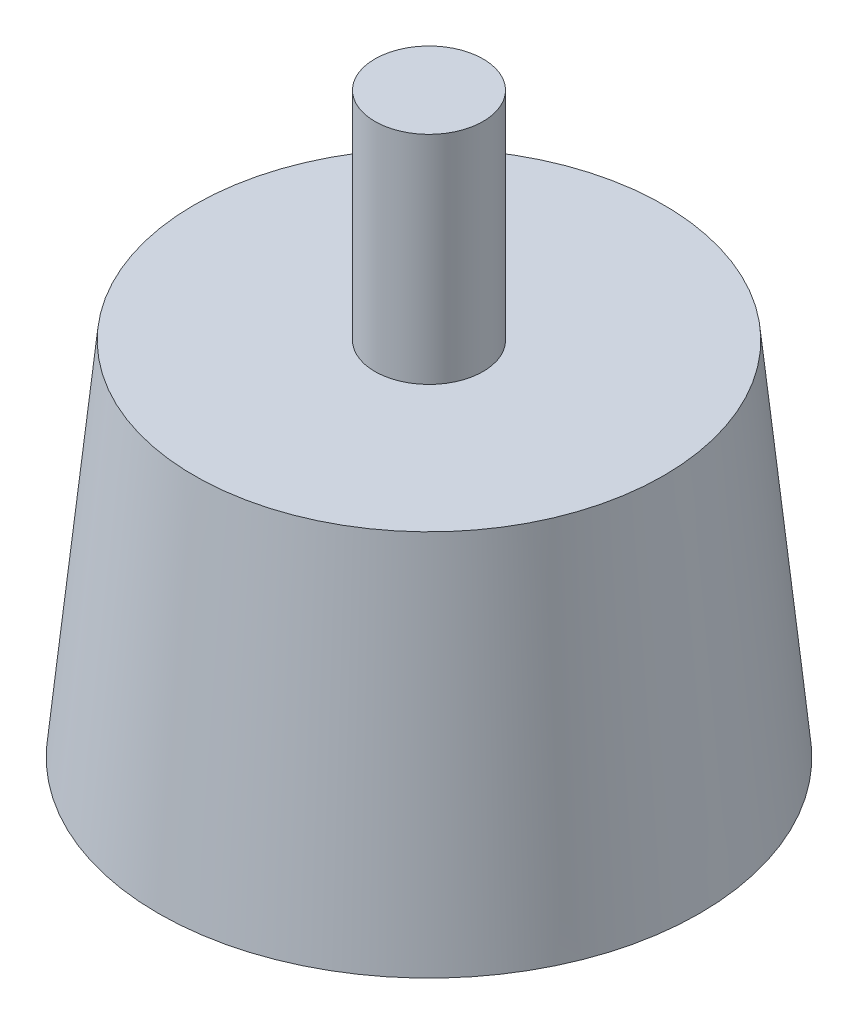
from build123d import *


with BuildPart() as part:
    # Sketch1 → Revolve1 (revolve)
    with BuildSketch(Plane.XY, mode=Mode.PRIVATE) as revolve1_sk:
        Polygon((0, 0), (15, 0), (13, 20), (3, 20), (3, 32), (0, 32), align=None)
    revolve(revolve1_sk.sketch.rotate(Axis((0, 32, 0), (0, -1, 0)), 180), axis=Axis((0, 32, 0), (0, -1, 0)))


solid = part.part
